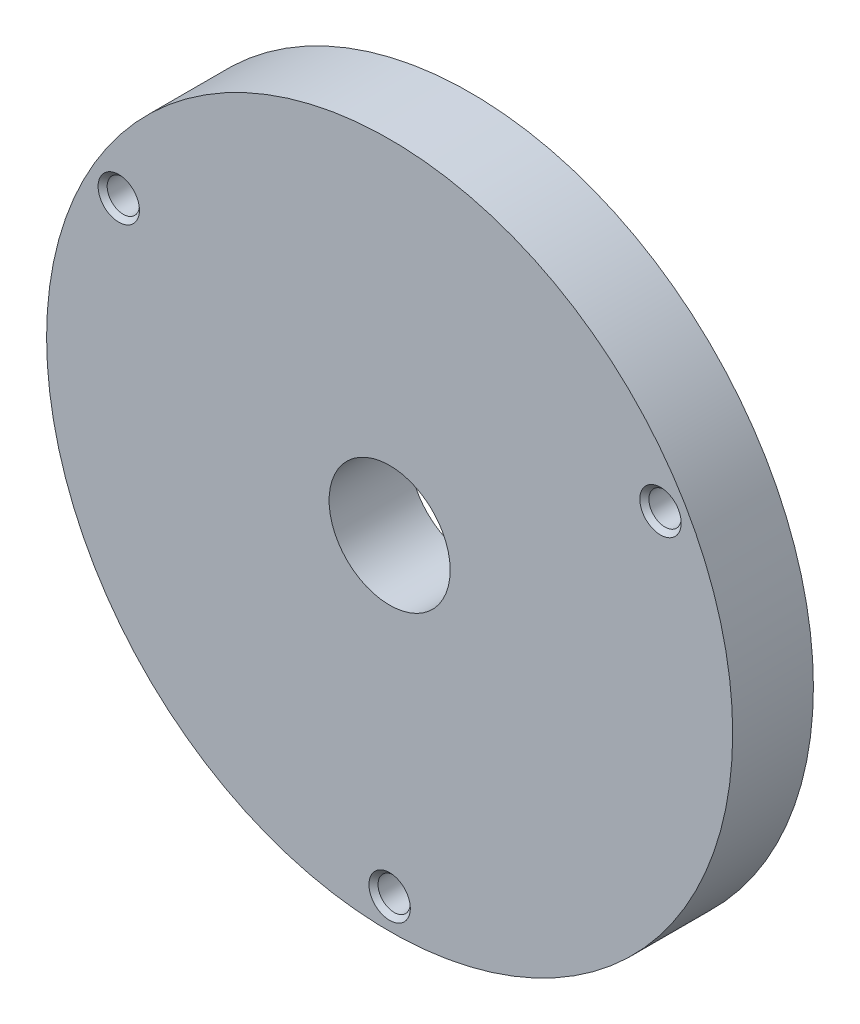
from build123d import *

# Parameters (mm, degrees)
SKETCH1_R                       = 17
BOSS_EXTRUDE1_DEPTH             = 4
M2X0_4_TAPPED_HOLE1_D           = 1.6
M2X0_4_TAPPED_HOLE1_CSINK_D     = 2.05
M2X0_4_TAPPED_HOLE1_CSINK_ANGLE = 90
CIRPATTERN1_COUNT               = 3
SKETCH4_R                       = 3
CUT_EXTRUDE1_DEPTH              = 25.372115214


with BuildPart() as part:
    # Sketch1 → Boss-Extrude1 (new body)
    with BuildSketch(Plane.XY):
        Circle(SKETCH1_R)
    extrude(amount=-BOSS_EXTRUDE1_DEPTH)

    # M2x0.4 Tapped Hole1 (through all)
    with Locations(Plane.XY):
        with Locations((0, -15.5)):
            m2x0_4_tapped_hole1 = CounterSinkHole(M2X0_4_TAPPED_HOLE1_D / 2, M2X0_4_TAPPED_HOLE1_CSINK_D / 2, counter_sink_angle=M2X0_4_TAPPED_HOLE1_CSINK_ANGLE)

    # CirPattern1: M2x0.4 Tapped Hole1 ×3 about axis
    cirpattern1_axis = Axis((0, 0, 0), (0, 0, 1))
    for i in range(1, CIRPATTERN1_COUNT):
        add(m2x0_4_tapped_hole1.rotate(cirpattern1_axis, i * 360 / CIRPATTERN1_COUNT), mode=Mode.SUBTRACT)

    # Sketch4 → Cut-Extrude1 (cut, through all)
    with BuildSketch(Plane.XY):
        Circle(SKETCH4_R)
    extrude(amount=-CUT_EXTRUDE1_DEPTH, mode=Mode.SUBTRACT)


solid = part.part
